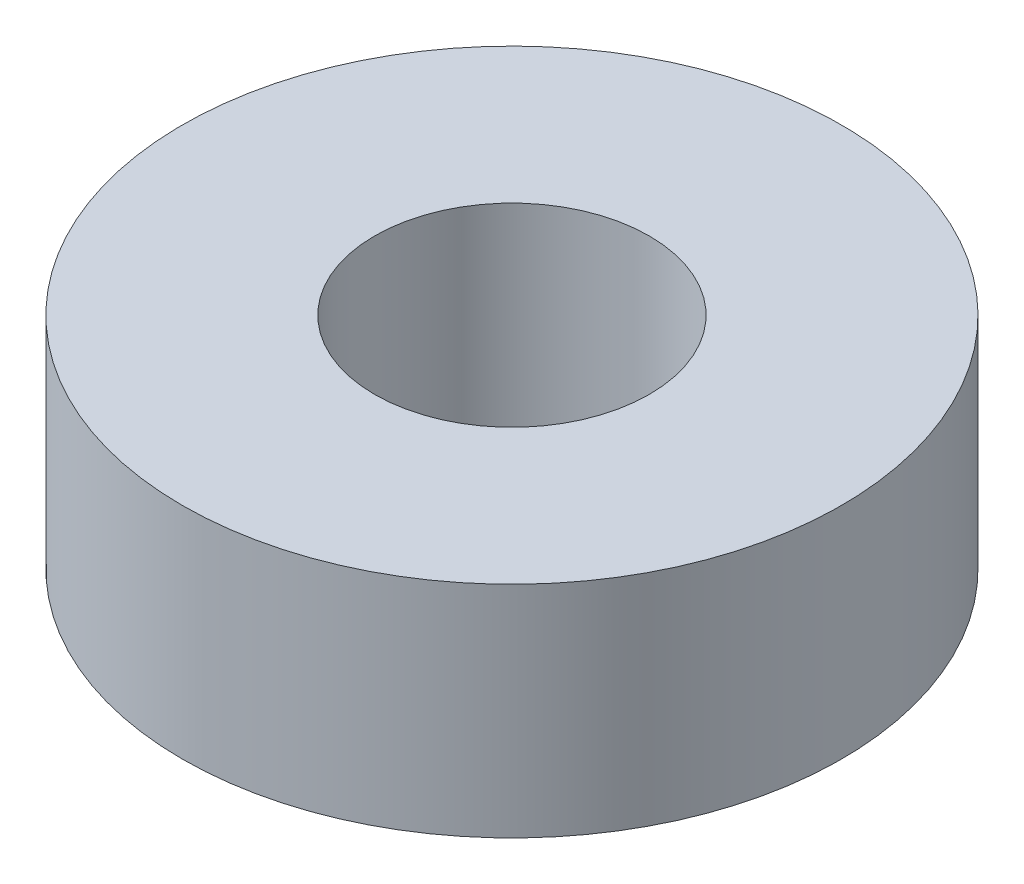
from build123d import *

# Parameters (mm, degrees)
SKETCH_1_R      = 6
SKETCH_1_R_2    = 2.5
EXTRUDE_1_DEPTH = 4


with BuildPart() as part:
    # 草图1 → 凸台-拉伸1 (new body)
    with BuildSketch(Plane(origin=(0, 0, 0), x_dir=(1, 0, 0), z_dir=(0, 1, 0))):
        with Locations(Location((0, 0, 0), (0, 0, 270))):
            Circle(SKETCH_1_R)
        with Locations(Location((0, 0, 0), (0, 0, 270))):
            Circle(SKETCH_1_R_2, mode=Mode.SUBTRACT)
    extrude(amount=EXTRUDE_1_DEPTH)


solid = part.part
